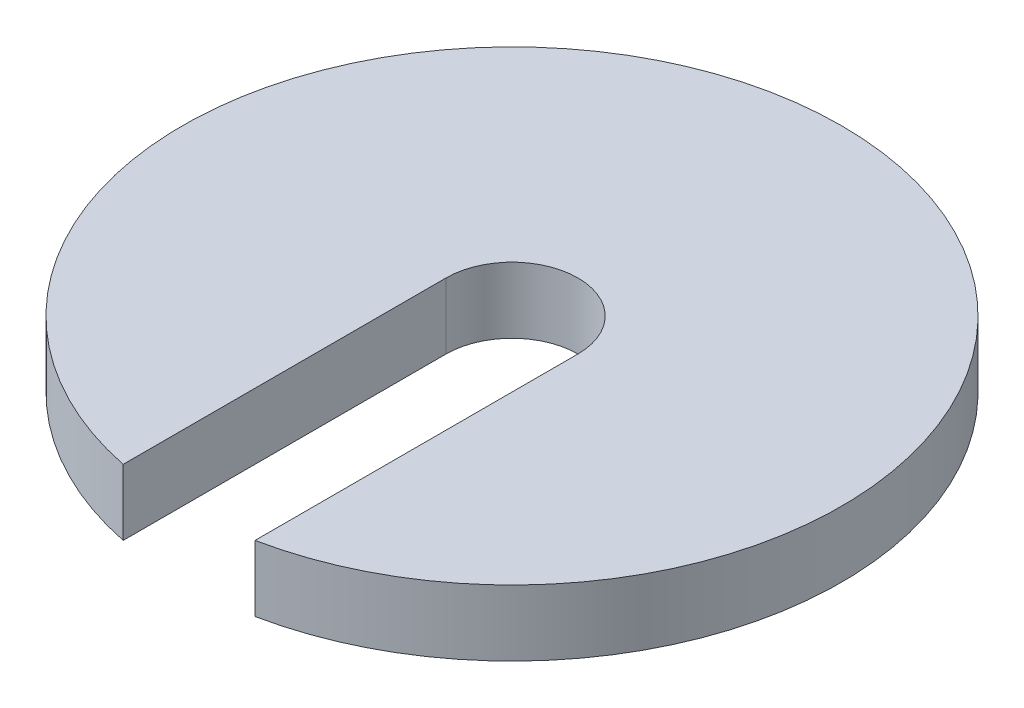
from build123d import *

# Parameters (mm, degrees)
BOSS_EXTRUDE1_DEPTH = 15


with BuildPart() as part:
    # Sketch1 → Boss-Extrude1 (new, symmetric)
    with BuildSketch(Plane(origin=(0, 0, 0), x_dir=(1, 0, 0), z_dir=(0, 1, 0))):
        with BuildLine():
            Line((-30, -146.969384567), (-30, 0))
            ThreePointArc((-30, 0), (0, 30), (30, 0))
            Line((30, 0), (30, -146.969384567))
            ThreePointArc((30, -146.969384567), (0, 150), (-30, -146.969384567))
        make_face()
    extrude(amount=BOSS_EXTRUDE1_DEPTH, both=True)


solid = part.part
